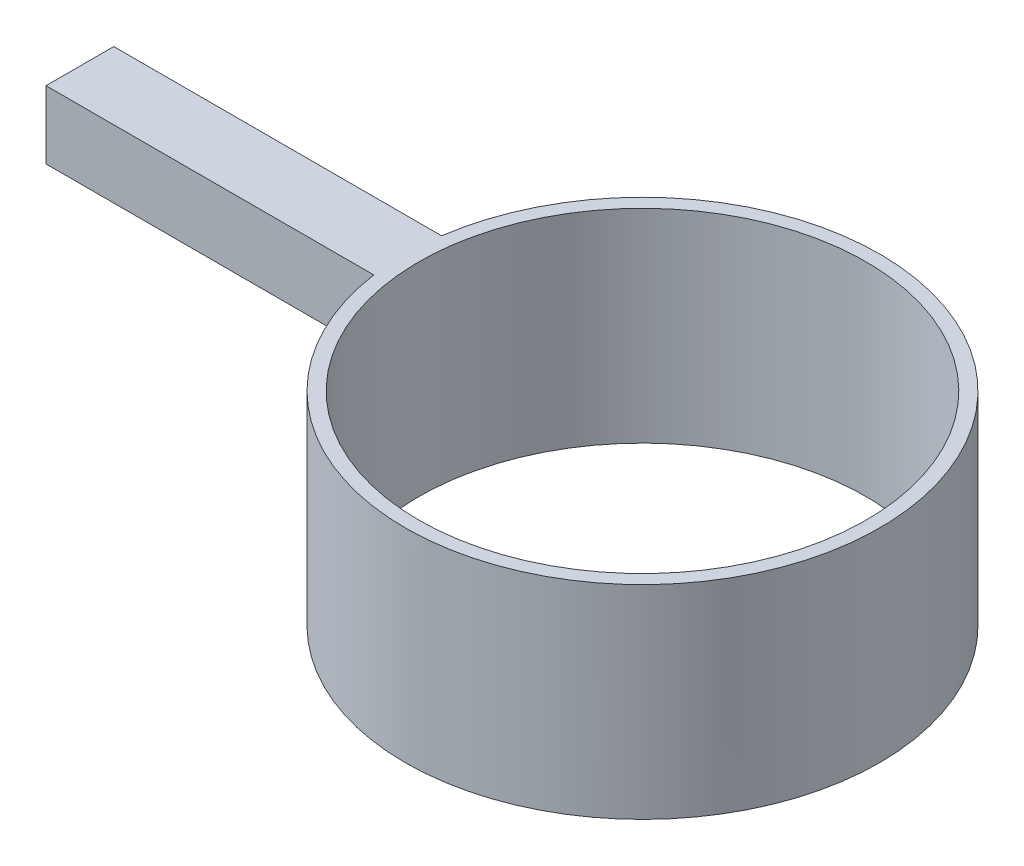
from build123d import *

# Parameters (mm, degrees)
SKETCH1_R           = 35
SKETCH1_R_2         = 33
BOSS_EXTRUDE1_DEPTH = 30
SKETCH2_W           = 50
SKETCH2_H           = 10
BOSS_EXTRUDE2_DEPTH = 10


with BuildPart() as part:
    # Sketch1 → Boss-Extrude1 (new body)
    with BuildSketch(Plane(origin=(0, 0, 0), x_dir=(1, 0, 0), z_dir=(0, 1, 0))):
        with Locations(Location((0, 0, 0), (0, 0, 270))):
            Circle(SKETCH1_R)
        with Locations(Location((0, 0, 0), (0, 0, 270))):
            Circle(SKETCH1_R_2, mode=Mode.SUBTRACT)
    extrude(amount=BOSS_EXTRUDE1_DEPTH)

    # Sketch2 → Boss-Extrude2 (add)
    with BuildSketch(Plane(origin=(0, 30, 0), x_dir=(1, 0, 0), z_dir=(0, 1, 0))):
        with Locations((-58, 0)):
            Rectangle(SKETCH2_W, SKETCH2_H)
    extrude(amount=-BOSS_EXTRUDE2_DEPTH)


solid = part.part
